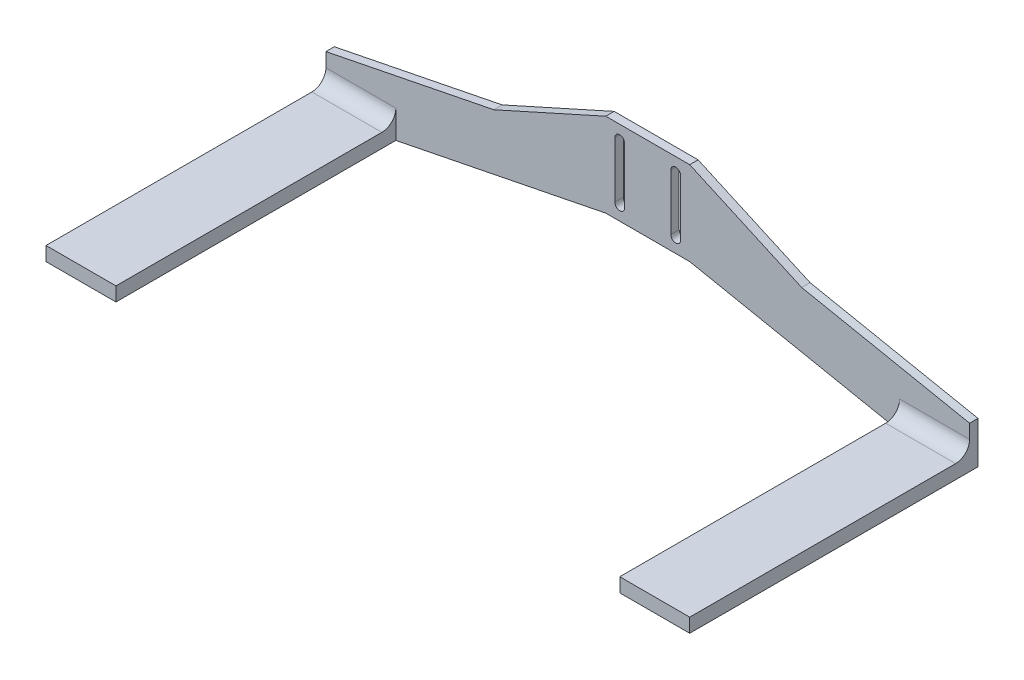
from build123d import *

# Parameters (mm, degrees)
SKETCH_1_W      = 30
SKETCH_1_H      = 30
EXTRUDE_1_DEPTH = 3
EXTRUDE_START   = -3
SKETCH_2_W      = 25
SKETCH_2_H      = 5
EXTRUDE_2_DEPTH = 100
FILLET_1_R      = 5


with BuildPart() as part:
    # 草图1 → 凸台-拉伸1 (new body)
    # profile 1 of 3: a face of its own
    with BuildSketch(Plane.XY):
        Rectangle(SKETCH_1_W, SKETCH_1_H)
        with BuildLine():
            Line((-11.75, -10), (-11.75, 10))
            ThreePointArc((-11.75, 10), (-10, 11.75), (-8.25, 10))
            Line((-8.25, 10), (-8.25, -10))
            ThreePointArc((-8.25, -10), (-10, -11.75), (-11.75, -10))
        make_face(mode=Mode.SUBTRACT)
        with BuildLine():
            ThreePointArc((8.25, 10), (10, 11.75), (11.75, 10))
            Line((11.75, 10), (11.75, -10))
            ThreePointArc((11.75, -10), (10, -11.75), (8.25, -10))
            Line((8.25, -10), (8.25, 10))
        make_face(mode=Mode.SUBTRACT)
    # profile 2 of 3: a face of its own
    with BuildSketch(Plane.XY):
        Polygon((-55, -3), (-15, 15), (-15, -15), (-90, -30), (-115, -30), (-115, -15), align=None)
    # profile 3 of 3: a face of its own
    with BuildSketch(Plane.XY):
        Polygon((15, 15), (15, -15), (90, -30), (115, -30), (115, -15), (55, -3), align=None)
    extrude(amount=EXTRUDE_1_DEPTH)

    # 草图2 → 凸台-拉伸2 (add)
    with BuildSketch(Plane(origin=(0, 0, 0), x_dir=(-1, 0, 0), z_dir=(0, 0, -1)).offset(EXTRUDE_START)):
        with Locations((-102.5, -27.5)):
            Rectangle(SKETCH_2_W, SKETCH_2_H)
        with Locations((102.5, -27.5)):
            Rectangle(SKETCH_2_W, SKETCH_2_H)
    extrude(amount=-EXTRUDE_2_DEPTH)

    # 圆角1
    fillet_1_edges = [part.edges().sort_by_distance(p)[0] for p in [
        (102.5, -25, 3),
        (-102.5, -25, 3),
    ]]
    fillet(fillet_1_edges, radius=FILLET_1_R)


solid = part.part
